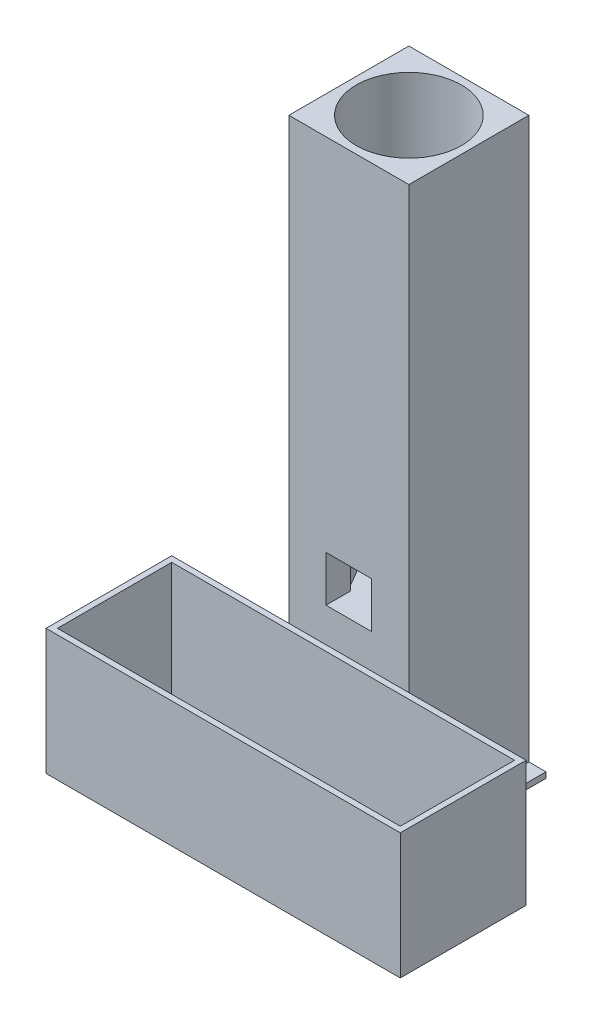
from build123d import *

# Parameters (mm, degrees)
BOSS_EXTRUDE1_DEPTH = 50
BOSS_EXTRUDE2_START = 50
SKETCH2_3_R         = 23
BOSS_EXTRUDE2_DEPTH = 127.5
BOSS_EXTRUDE3_DEPTH = 177.5
SKETCH3_W           = 52.5
SKETCH3_H           = 52.5
BOSS_EXTRUDE4_DEPTH = 70
SKETCH4_W           = 150
SKETCH4_H           = 50
BOSS_EXTRUDE5_DEPTH = 2.5
SKETCH4_4_W         = 155
SKETCH4_4_H         = 55
SKETCH4_4_W_2       = 150
SKETCH4_4_H_2       = 50
BOSS_EXTRUDE6_DEPTH = 55
SKETCH5_W           = 47.5
SKETCH5_H           = 47.5
CUT_EXTRUDE4_DEPTH  = 50
SKETCH6_W           = 20
SKETCH6_H           = 20
CUT_EXTRUDE5_DEPTH  = 20
SKETCH7_W           = 7.5
SKETCH7_H           = 52.5
SKETCH7_R           = 1.65
BOSS_EXTRUDE7_DEPTH = 2.5


with BuildPart() as part:
    # Sketch2 → Boss-Extrude1 (new body)
    with BuildSketch(Plane(origin=(0, 0, 0), x_dir=(1, 0, 0), z_dir=(0, 1, 0))):
        with BuildLine():
            ThreePointArc((-26.25, -11.459990061), (-20.253319138, -20.253319138), (-11.459990061, -26.25))
            Line((-11.459990061, -26.25), (11.459990061, -26.25))
            ThreePointArc((11.459990061, -26.25), (20.253319138, -20.253319138), (26.25, -11.459990061))
            Line((26.25, -11.459990061), (26.25, 11.459990061))
            ThreePointArc((26.25, 11.459990061), (20.253319138, 20.253319138), (11.459990061, 26.25))
            Line((11.459990061, 26.25), (-11.459990061, 26.25))
            ThreePointArc((-11.459990061, 26.25), (-20.253319138, 20.253319138), (-26.25, 11.459990061))
            Line((-26.25, 11.459990061), (-26.25, -11.459990061))
        make_face()
        Polygon((-7.1, 17.237560734), (7.1, 17.237560734), (11.378165495, 14.767560734), (18.478165495, 2.47), (18.478165495, -2.47), (11.378165495, -14.767560734), (7.1, -17.237560734), (-7.1, -17.237560734), (-11.378165495, -14.767560734), (-18.478165495, -2.47), (-18.478165495, 2.47), (-11.378165495, 14.767560734), align=None, mode=Mode.SUBTRACT)
    extrude(amount=BOSS_EXTRUDE1_DEPTH)

    # Sketch2<3> → Boss-Extrude2 (add)
    with BuildSketch(Plane(origin=(0, 0, 0), x_dir=(1, 0, 0), z_dir=(0, 1, 0)).offset(BOSS_EXTRUDE2_START)):
        with BuildLine():
            ThreePointArc((-26.25, -11.459990061), (-20.253319138, -20.253319138), (-11.459990061, -26.25))
            Line((-11.459990061, -26.25), (11.459990061, -26.25))
            ThreePointArc((11.459990061, -26.25), (20.253319138, -20.253319138), (26.25, -11.459990061))
            Line((26.25, -11.459990061), (26.25, 11.459990061))
            ThreePointArc((26.25, 11.459990061), (20.253319138, 20.253319138), (11.459990061, 26.25))
            Line((11.459990061, 26.25), (-11.459990061, 26.25))
            ThreePointArc((-11.459990061, 26.25), (-20.253319138, 20.253319138), (-26.25, 11.459990061))
            Line((-26.25, 11.459990061), (-26.25, -11.459990061))
        make_face()
        with Locations(Location((0, 0, 0), (0, 0, 270))):
            Circle(SKETCH2_3_R, mode=Mode.SUBTRACT)
    extrude(amount=BOSS_EXTRUDE2_DEPTH)

    # Sketch2<4> → Boss-Extrude3 (add)
    with BuildSketch(Plane(origin=(0, 0, 0), x_dir=(1, 0, 0), z_dir=(0, 1, 0))):
        with BuildLine():
            Line((-26.25, 26.25), (-26.25, 11.459990061))
            ThreePointArc((-26.25, 11.459990061), (-20.253319138, 20.253319138), (-11.459990061, 26.25))
            Line((-11.459990061, 26.25), (-26.25, 26.25))
        make_face()
        with BuildLine():
            ThreePointArc((11.459990061, 26.25), (20.253319138, 20.253319138), (26.25, 11.459990061))
            Line((26.25, 11.459990061), (26.25, 26.25))
            Line((26.25, 26.25), (11.459990061, 26.25))
        make_face()
        with BuildLine():
            ThreePointArc((26.25, -11.459990061), (20.253319138, -20.253319138), (11.459990061, -26.25))
            Line((11.459990061, -26.25), (26.25, -26.25))
            Line((26.25, -26.25), (26.25, -11.459990061))
        make_face()
        with BuildLine():
            Line((-26.25, -11.459990061), (-26.25, -26.25))
            Line((-26.25, -26.25), (-11.459990061, -26.25))
            ThreePointArc((-11.459990061, -26.25), (-20.253319138, -20.253319138), (-26.25, -11.459990061))
        make_face()
    extrude(amount=BOSS_EXTRUDE3_DEPTH)

    # Sketch3 → Boss-Extrude4 (add)
    with BuildSketch(Plane.XZ):
        Rectangle(SKETCH3_W, SKETCH3_H)
    extrude(amount=BOSS_EXTRUDE4_DEPTH)



with BuildPart() as body_2:
    # Sketch4 → Boss-Extrude5 (new body)
    with BuildSketch(Plane(origin=(0, -70, 0), x_dir=(-1, 0, 0), z_dir=(0, -1, 0))):
        with Locations((0, -53.75)):
            Rectangle(SKETCH4_W, SKETCH4_H)
    extrude(amount=-BOSS_EXTRUDE5_DEPTH)


with BuildPart() as part_1:
    add(part.part)

    add(body_2.part)  # Boss-Extrude6 merges body 2
    # Sketch4<4> → Boss-Extrude6 (add)
    with BuildSketch(Plane(origin=(0, -70, 0), x_dir=(-1, 0, 0), z_dir=(0, -1, 0))):
        with Locations((0, -53.75)):
            Rectangle(SKETCH4_4_W, SKETCH4_4_H)
        with Locations((0, -53.75)):
            Rectangle(SKETCH4_4_W_2, SKETCH4_4_H_2, mode=Mode.SUBTRACT)
    extrude(amount=-BOSS_EXTRUDE6_DEPTH)

    # Sketch5 → Cut-Extrude4 (cut)
    with BuildSketch(Plane.XZ.offset(70)):
        Rectangle(SKETCH5_W, SKETCH5_H)
    extrude(amount=-CUT_EXTRUDE4_DEPTH, mode=Mode.SUBTRACT)

    # Sketch6 → Cut-Extrude5 (cut)
    with BuildSketch(Plane.XY.offset(26.25)):
        with Locations((0, 10)):
            Rectangle(SKETCH6_W, SKETCH6_H)
    extrude(amount=-CUT_EXTRUDE5_DEPTH, mode=Mode.SUBTRACT)

    # Sketch7 → Boss-Extrude7 (add)
    # profile 1 of 2: a face of its own
    with BuildSketch(Plane.XZ.offset(70)):
        with Locations((-30, 0)):
            Rectangle(SKETCH7_W, SKETCH7_H)
        with Locations(Location((-30, 0, 0), (0, 0, 270))):
            Circle(SKETCH7_R, mode=Mode.SUBTRACT)
    # profile 2 of 2: a face of its own
    with BuildSketch(Plane.XZ.offset(70)):
        with Locations((30, 0)):
            Rectangle(SKETCH7_W, SKETCH7_H)
        with Locations(Location((30, 0, 0), (0, 0, 270))):
            Circle(SKETCH7_R, mode=Mode.SUBTRACT)
    extrude(amount=-BOSS_EXTRUDE7_DEPTH)


solid = part_1.part
